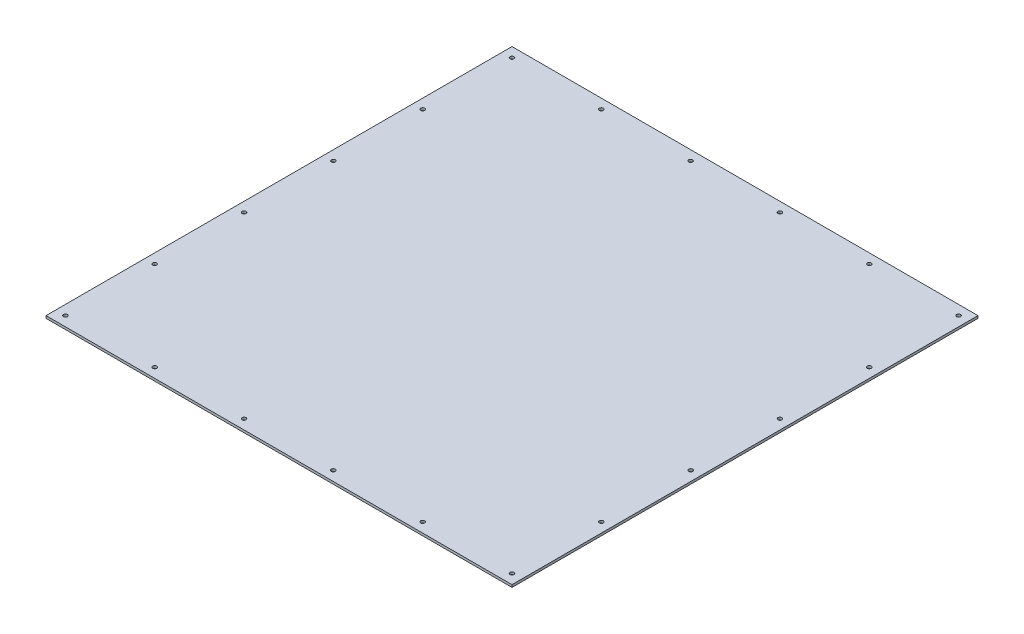
from build123d import *

# Parameters (mm, degrees)
SKETCH1_W                  = 609.6
SKETCH1_H                  = 609.6
BOSS_EXTRUDE1_DEPTH        = 3.175
F_6_0_204_DIAMETER_HOLE1_D = 5.1816


with BuildPart() as part:
    # Sketch1 → Boss-Extrude1 (new body)
    with BuildSketch(Plane(origin=(0, 0, 0), x_dir=(1, 0, 0), z_dir=(0, 1, 0))):
        Rectangle(SKETCH1_W, SKETCH1_H)
    extrude(amount=BOSS_EXTRUDE1_DEPTH)

    # #6 (0.204) Diameter Hole1 (through all)
    with Locations(Plane(origin=(0, 3.175, 0), x_dir=(1, 0, 0), z_dir=(0, 1, 0))):
        with Locations((-292.1, 292.1), (-175.26, 292.1), (-58.42, 292.1), (58.42, 292.1), (175.26, 292.1), (-292.1, 175.26), (-292.1, 58.42), (-292.1, -58.42), (-292.1, -175.26), (175.26, -292.1), (58.42, -292.1), (-58.42, -292.1), (-175.26, -292.1), (-292.1, -292.1), (292.1, -292.1), (292.1, -175.26), (292.1, -58.42), (292.1, 58.42), (292.1, 175.26), (292.1, 292.1)):
            Hole(F_6_0_204_DIAMETER_HOLE1_D / 2)


solid = part.part
